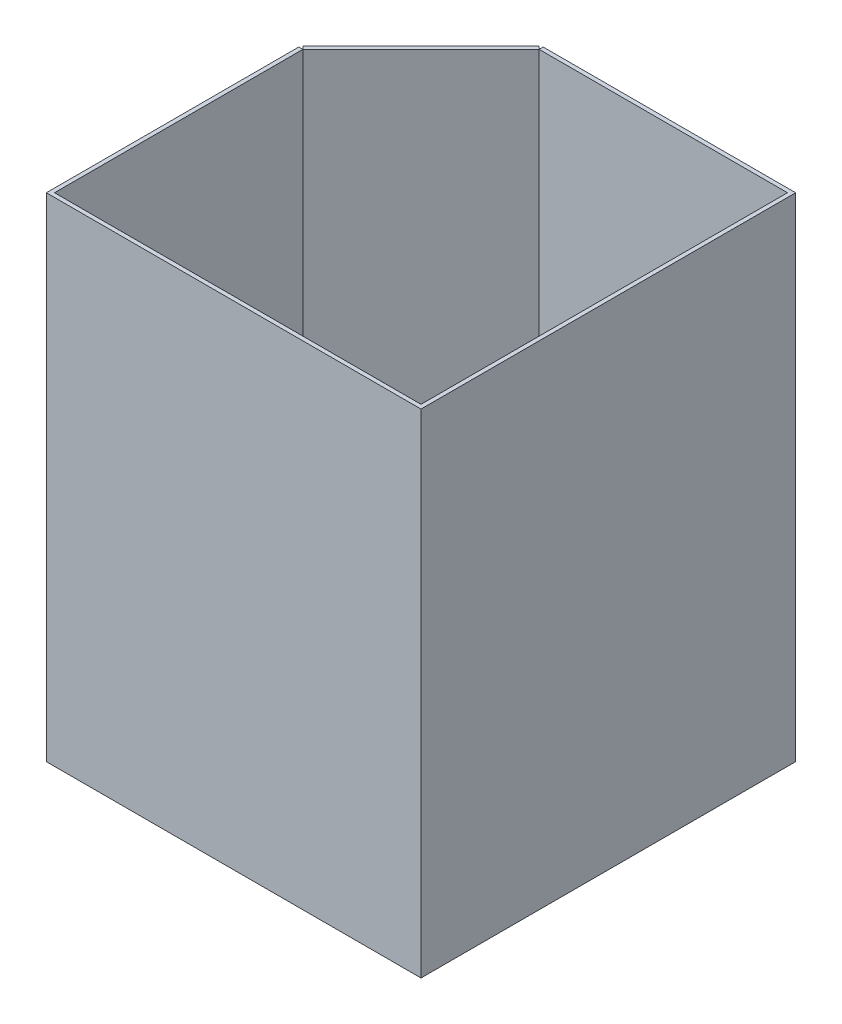
from build123d import *

# Parameters (mm, degrees)
BOSS_EXTRUDE1_DEPTH = 300
BOSS_EXTRUDE2_DEPTH = 2.5


with BuildPart() as part:
    # Sketch1 → Boss-Extrude1 (new body)
    with BuildSketch(Plane(origin=(0, 0, 0), x_dir=(1, 0, 0), z_dir=(0, 1, 0))):
        Polygon((-41.767766953, 114.267766953), (-114.267766953, 41.767766953), (-112.770991517, 40.270991517), (-112.877581569, 40), (-115, 40), (-115, -115), (115, -115), (115, 115), (-40, 115), (-40, 113.078362506), (-40.344526552, 112.844526552), align=None)
        Polygon((-112.5, -112.5), (112.5, -112.5), (112.5, 112.5), (-40, 112.5), (-112.5, 40), align=None, mode=Mode.SUBTRACT)
    extrude(amount=BOSS_EXTRUDE1_DEPTH)

    # Sketch2 → Boss-Extrude2 (add)
    with BuildSketch(Plane.XZ):
        Polygon((115, -115), (115, 115), (-115, 115), (-115, -40), (-112.877581569, -40), (-112.770991517, -40.270991517), (-114.267766953, -41.767766953), (-41.767766953, -114.267766953), (-40.344526552, -112.844526552), (-40, -113.078362506), (-40, -115), align=None)
    extrude(amount=BOSS_EXTRUDE2_DEPTH)


solid = part.part
